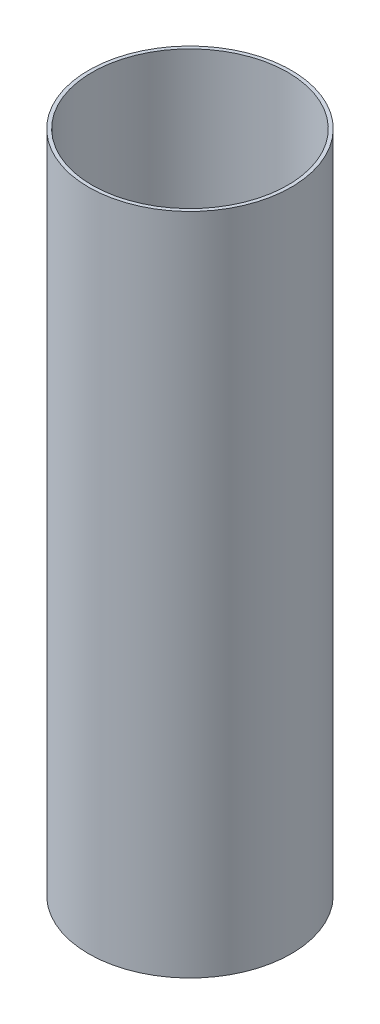
from build123d import *

# Parameters (mm, degrees)
SKETCH1_R           = 92.075
SKETCH1_R_2         = 88.9
BOSS_EXTRUDE1_DEPTH = 301.625


with BuildPart() as part:
    # Sketch1 → Boss-Extrude1 (new, symmetric)
    with BuildSketch(Plane(origin=(0, 0, 0), x_dir=(1, 0, 0), z_dir=(0, 1, 0))):
        with Locations(Location((0, 0, 0), (0, 0, 270))):
            Circle(SKETCH1_R)
        with Locations(Location((0, 0, 0), (0, 0, 270))):
            Circle(SKETCH1_R_2, mode=Mode.SUBTRACT)
    extrude(amount=BOSS_EXTRUDE1_DEPTH, both=True)


solid = part.part
